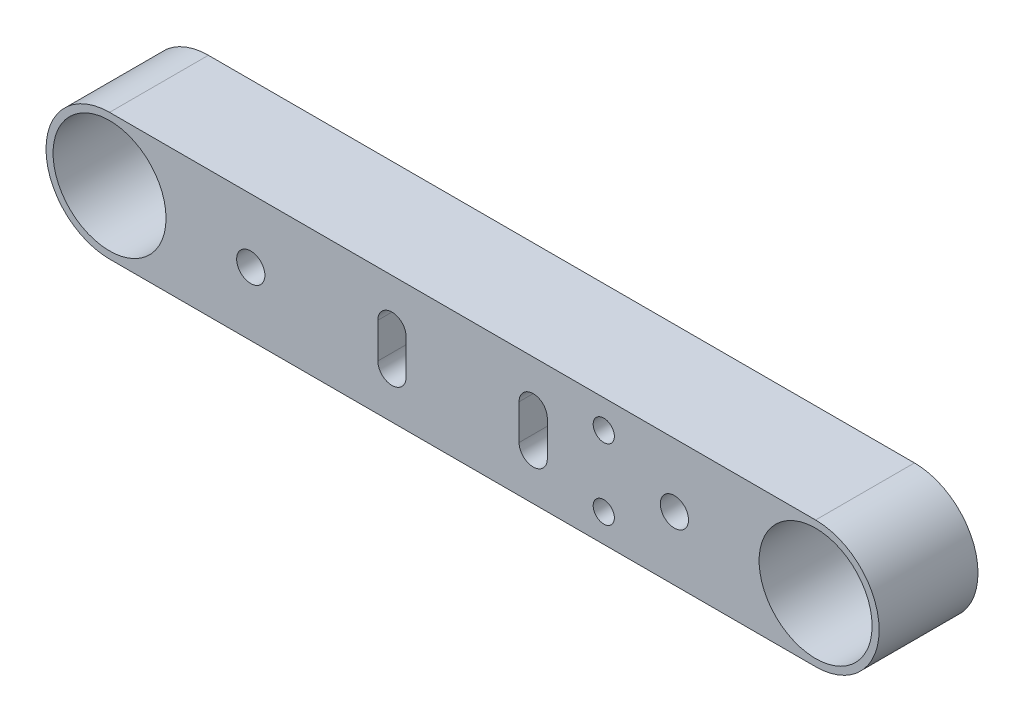
from build123d import *

# Parameters (mm, degrees)
SKETCH1_R           = 2
SKETCH1_R_2         = 8
SKETCH1_R_3         = 1.5
BOSS_EXTRUDE1_DEPTH = 7


with BuildPart() as part:
    # Sketch1 → Boss-Extrude1 (new, symmetric)
    with BuildSketch(Plane.XY):
        with BuildLine():
            Line((-50, 9), (50, 9))
            ThreePointArc((50, 9), (59, 0), (50, -9))
            Line((50, -9), (-50, -9))
            ThreePointArc((-50, -9), (-59, 0), (-50, 9))
        make_face()
        with Locations((-30, 0)):
            Circle(SKETCH1_R, mode=Mode.SUBTRACT)
        with Locations((30, 0)):
            Circle(SKETCH1_R, mode=Mode.SUBTRACT)
        with Locations((-50, 0)):
            Circle(SKETCH1_R_2, mode=Mode.SUBTRACT)
        with Locations((50, 0)):
            Circle(SKETCH1_R_2, mode=Mode.SUBTRACT)
        with Locations((20, -5)):
            Circle(SKETCH1_R_3, mode=Mode.SUBTRACT)
        with Locations((20, 5)):
            Circle(SKETCH1_R_3, mode=Mode.SUBTRACT)
        with BuildLine():
            Line((-12, -2.5), (-12, 2.5))
            ThreePointArc((-12, 2.5), (-10, 4.5), (-8, 2.5))
            Line((-8, 2.5), (-8, -2.5))
            ThreePointArc((-8, -2.5), (-10, -4.5), (-12, -2.5))
        make_face(mode=Mode.SUBTRACT)
        with BuildLine():
            Line((12, -2.5), (12, 2.5))
            ThreePointArc((12, 2.5), (10, 4.5), (8, 2.5))
            Line((8, 2.5), (8, -2.5))
            ThreePointArc((8, -2.5), (10, -4.5), (12, -2.5))
        make_face(mode=Mode.SUBTRACT)
    extrude(amount=BOSS_EXTRUDE1_DEPTH, both=True)


solid = part.part
